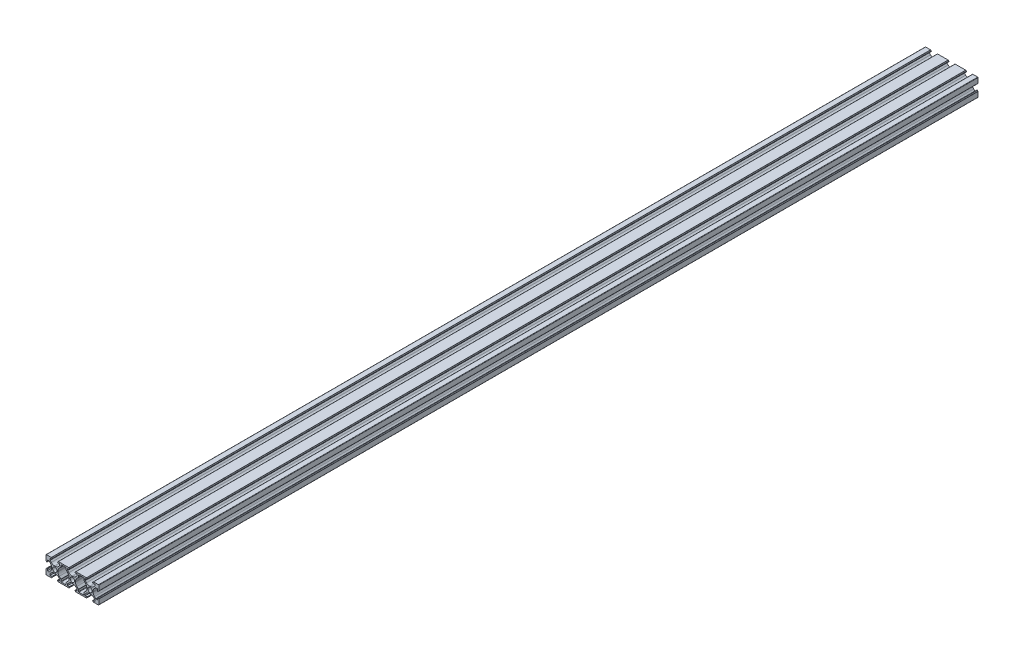
from build123d import *

# Parameters (mm, degrees)
RESSALTO_EXTRUS_O1_DEPTH    = 1000
PADR_OCIRCULAR1_COUNT       = 4
PADR_O_LINEAR1_COUNT        = 3
PADR_O_LINEAR1_PITCH        = 20
PADR_O_LINEAR1_COPY_1_DEPTH = 1000
PADR_O_LINEAR1_COPY_2_DEPTH = 1000
PADR_O_LINEAR1_COPY_3_DEPTH = 1000
PADR_O_LINEAR1_COPY_4_DEPTH = 1000
PADR_O_LINEAR1_COPY_5_DEPTH = 1000
PADR_O_LINEAR1_COPY_6_DEPTH = 1000
CORTE_EXTRUS_O1_DEPTH       = 1002.299156097
PADR_O_LINEAR2_COUNT        = 2
PADR_O_LINEAR2_PITCH        = 20
FILETE1_R                   = 0.4
FILETE2_R                   = 0.4


with BuildPart() as part:
    # Esboço1 → Ressalto-extrusão1 (new body)
    with BuildSketch(Plane.XY):
        with BuildLine():
            ThreePointArc((-9.317157288, 3.217157288), (-9.187387948, 3.130448187), (-9.034314575, 3.1))
            Line((-9.034314575, 3.1), (-8.9, 3.1))
            ThreePointArc((-8.9, 3.1), (-8.617157288, 3.217157288), (-8.5, 3.5))
            Line((-8.5, 3.5), (-8.5, 5.5))
            Line((-8.5, 5.5), (-6.560660172, 5.5))
            Line((-6.560660172, 5.5), (-5.064466094, 4.003805922))
            ThreePointArc((-5.064466094, 4.003805922), (-3.980602337, 2.381689178), (-3.6, 0.468272016))
            Line((-3.6, 0.468272016), (-3.6, 0))
            Line((-3.6, 0), (-2.5, 0))
            ThreePointArc((-2.5, 0), (-1.767766953, 1.767766953), (0, 2.5))
            Line((0, 2.5), (0, 3.6))
            Line((0, 3.6), (-0.468272016, 3.6))
            ThreePointArc((-0.468272016, 3.6), (-2.381689178, 3.980602337), (-4.003805922, 5.064466094))
            Line((-4.003805922, 5.064466094), (-5.5, 6.560660172))
            Line((-5.5, 6.560660172), (-5.5, 8.5))
            Line((-5.5, 8.5), (-3.5, 8.5))
            ThreePointArc((-3.5, 8.5), (-3.217157288, 8.617157288), (-3.1, 8.9))
            Line((-3.1, 8.9), (-3.1, 9.034314575))
            ThreePointArc((-3.1, 9.034314575), (-3.130448187, 9.187387948), (-3.217157288, 9.317157288))
            Line((-3.217157288, 9.317157288), (-3.782842712, 9.882842712))
            ThreePointArc((-3.782842712, 9.882842712), (-3.912612052, 9.969551813), (-4.065685425, 10))
            Line((-4.065685425, 10), (-10, 10))
            Line((-10, 10), (-10, 4.065685425))
            ThreePointArc((-10, 4.065685425), (-9.969551813, 3.912612052), (-9.882842712, 3.782842712))
            Line((-9.882842712, 3.782842712), (-9.317157288, 3.217157288))
        make_face()
    ressalto_extrus_o1 = extrude(amount=RESSALTO_EXTRUS_O1_DEPTH)

    # PadrãoCircular1: Ressalto-extrusão1 ×4 about axis
    padr_ocircular1_axis = Axis((0, 0, 0), (0, 0, 1))
    for i in range(1, PADR_OCIRCULAR1_COUNT):
        add(ressalto_extrus_o1.rotate(padr_ocircular1_axis, i * 360 / PADR_OCIRCULAR1_COUNT))

    # Padrão linear1: Ressalto-extrusão1 ×3
    with Locations(*[(i * PADR_O_LINEAR1_PITCH, 0, 0) for i in range(1, PADR_O_LINEAR1_COUNT)]):
        add(ressalto_extrus_o1)

    # Padrão linear1 copy 1 sketch → Padrão linear1 copy 1 (add)
    with BuildSketch(Plane(origin=(20, 0, 0), x_dir=(0, 1, 0), z_dir=(0, 0, 1))):
        with BuildLine():
            ThreePointArc((-9.317157288, 3.217157288), (-9.187387948, 3.130448187), (-9.034314575, 3.1))
            Line((-9.034314575, 3.1), (-8.9, 3.1))
            ThreePointArc((-8.9, 3.1), (-8.617157288, 3.217157288), (-8.5, 3.5))
            Line((-8.5, 3.5), (-8.5, 5.5))
            Line((-8.5, 5.5), (-6.560660172, 5.5))
            Line((-6.560660172, 5.5), (-5.064466094, 4.003805922))
            ThreePointArc((-5.064466094, 4.003805922), (-3.980602337, 2.381689178), (-3.6, 0.468272016))
            Line((-3.6, 0.468272016), (-3.6, 0))
            Line((-3.6, 0), (-2.5, 0))
            ThreePointArc((-2.5, 0), (-1.767766953, 1.767766953), (0, 2.5))
            Line((0, 2.5), (0, 3.6))
            Line((0, 3.6), (-0.468272016, 3.6))
            ThreePointArc((-0.468272016, 3.6), (-2.381689178, 3.980602337), (-4.003805922, 5.064466094))
            Line((-4.003805922, 5.064466094), (-5.5, 6.560660172))
            Line((-5.5, 6.560660172), (-5.5, 8.5))
            Line((-5.5, 8.5), (-3.5, 8.5))
            ThreePointArc((-3.5, 8.5), (-3.217157288, 8.617157288), (-3.1, 8.9))
            Line((-3.1, 8.9), (-3.1, 9.034314575))
            ThreePointArc((-3.1, 9.034314575), (-3.130448187, 9.187387948), (-3.217157288, 9.317157288))
            Line((-3.217157288, 9.317157288), (-3.782842712, 9.882842712))
            ThreePointArc((-3.782842712, 9.882842712), (-3.912612052, 9.969551813), (-4.065685425, 10))
            Line((-4.065685425, 10), (-10, 10))
            Line((-10, 10), (-10, 4.065685425))
            ThreePointArc((-10, 4.065685425), (-9.969551813, 3.912612052), (-9.882842712, 3.782842712))
            Line((-9.882842712, 3.782842712), (-9.317157288, 3.217157288))
        make_face()
    extrude(amount=PADR_O_LINEAR1_COPY_1_DEPTH)

    # Padrão linear1 copy 2 sketch → Padrão linear1 copy 2 (add)
    with BuildSketch(Plane(origin=(40, 0, 0), x_dir=(0, 1, 0), z_dir=(0, 0, 1))):
        with BuildLine():
            ThreePointArc((-9.317157288, 3.217157288), (-9.187387948, 3.130448187), (-9.034314575, 3.1))
            Line((-9.034314575, 3.1), (-8.9, 3.1))
            ThreePointArc((-8.9, 3.1), (-8.617157288, 3.217157288), (-8.5, 3.5))
            Line((-8.5, 3.5), (-8.5, 5.5))
            Line((-8.5, 5.5), (-6.560660172, 5.5))
            Line((-6.560660172, 5.5), (-5.064466094, 4.003805922))
            ThreePointArc((-5.064466094, 4.003805922), (-3.980602337, 2.381689178), (-3.6, 0.468272016))
            Line((-3.6, 0.468272016), (-3.6, 0))
            Line((-3.6, 0), (-2.5, 0))
            ThreePointArc((-2.5, 0), (-1.767766953, 1.767766953), (0, 2.5))
            Line((0, 2.5), (0, 3.6))
            Line((0, 3.6), (-0.468272016, 3.6))
            ThreePointArc((-0.468272016, 3.6), (-2.381689178, 3.980602337), (-4.003805922, 5.064466094))
            Line((-4.003805922, 5.064466094), (-5.5, 6.560660172))
            Line((-5.5, 6.560660172), (-5.5, 8.5))
            Line((-5.5, 8.5), (-3.5, 8.5))
            ThreePointArc((-3.5, 8.5), (-3.217157288, 8.617157288), (-3.1, 8.9))
            Line((-3.1, 8.9), (-3.1, 9.034314575))
            ThreePointArc((-3.1, 9.034314575), (-3.130448187, 9.187387948), (-3.217157288, 9.317157288))
            Line((-3.217157288, 9.317157288), (-3.782842712, 9.882842712))
            ThreePointArc((-3.782842712, 9.882842712), (-3.912612052, 9.969551813), (-4.065685425, 10))
            Line((-4.065685425, 10), (-10, 10))
            Line((-10, 10), (-10, 4.065685425))
            ThreePointArc((-10, 4.065685425), (-9.969551813, 3.912612052), (-9.882842712, 3.782842712))
            Line((-9.882842712, 3.782842712), (-9.317157288, 3.217157288))
        make_face()
    extrude(amount=PADR_O_LINEAR1_COPY_2_DEPTH)

    # Padrão linear1 copy 3 sketch → Padrão linear1 copy 3 (add)
    with BuildSketch(Plane(origin=(20, 0, 0), x_dir=(-1, 0, 0), z_dir=(0, 0, 1))):
        with BuildLine():
            ThreePointArc((-9.317157288, 3.217157288), (-9.187387948, 3.130448187), (-9.034314575, 3.1))
            Line((-9.034314575, 3.1), (-8.9, 3.1))
            ThreePointArc((-8.9, 3.1), (-8.617157288, 3.217157288), (-8.5, 3.5))
            Line((-8.5, 3.5), (-8.5, 5.5))
            Line((-8.5, 5.5), (-6.560660172, 5.5))
            Line((-6.560660172, 5.5), (-5.064466094, 4.003805922))
            ThreePointArc((-5.064466094, 4.003805922), (-3.980602337, 2.381689178), (-3.6, 0.468272016))
            Line((-3.6, 0.468272016), (-3.6, 0))
            Line((-3.6, 0), (-2.5, 0))
            ThreePointArc((-2.5, 0), (-1.767766953, 1.767766953), (0, 2.5))
            Line((0, 2.5), (0, 3.6))
            Line((0, 3.6), (-0.468272016, 3.6))
            ThreePointArc((-0.468272016, 3.6), (-2.381689178, 3.980602337), (-4.003805922, 5.064466094))
            Line((-4.003805922, 5.064466094), (-5.5, 6.560660172))
            Line((-5.5, 6.560660172), (-5.5, 8.5))
            Line((-5.5, 8.5), (-3.5, 8.5))
            ThreePointArc((-3.5, 8.5), (-3.217157288, 8.617157288), (-3.1, 8.9))
            Line((-3.1, 8.9), (-3.1, 9.034314575))
            ThreePointArc((-3.1, 9.034314575), (-3.130448187, 9.187387948), (-3.217157288, 9.317157288))
            Line((-3.217157288, 9.317157288), (-3.782842712, 9.882842712))
            ThreePointArc((-3.782842712, 9.882842712), (-3.912612052, 9.969551813), (-4.065685425, 10))
            Line((-4.065685425, 10), (-10, 10))
            Line((-10, 10), (-10, 4.065685425))
            ThreePointArc((-10, 4.065685425), (-9.969551813, 3.912612052), (-9.882842712, 3.782842712))
            Line((-9.882842712, 3.782842712), (-9.317157288, 3.217157288))
        make_face()
    extrude(amount=PADR_O_LINEAR1_COPY_3_DEPTH)

    # Padrão linear1 copy 4 sketch → Padrão linear1 copy 4 (add)
    with BuildSketch(Plane(origin=(40, 0, 0), x_dir=(-1, 0, 0), z_dir=(0, 0, 1))):
        with BuildLine():
            ThreePointArc((-9.317157288, 3.217157288), (-9.187387948, 3.130448187), (-9.034314575, 3.1))
            Line((-9.034314575, 3.1), (-8.9, 3.1))
            ThreePointArc((-8.9, 3.1), (-8.617157288, 3.217157288), (-8.5, 3.5))
            Line((-8.5, 3.5), (-8.5, 5.5))
            Line((-8.5, 5.5), (-6.560660172, 5.5))
            Line((-6.560660172, 5.5), (-5.064466094, 4.003805922))
            ThreePointArc((-5.064466094, 4.003805922), (-3.980602337, 2.381689178), (-3.6, 0.468272016))
            Line((-3.6, 0.468272016), (-3.6, 0))
            Line((-3.6, 0), (-2.5, 0))
            ThreePointArc((-2.5, 0), (-1.767766953, 1.767766953), (0, 2.5))
            Line((0, 2.5), (0, 3.6))
            Line((0, 3.6), (-0.468272016, 3.6))
            ThreePointArc((-0.468272016, 3.6), (-2.381689178, 3.980602337), (-4.003805922, 5.064466094))
            Line((-4.003805922, 5.064466094), (-5.5, 6.560660172))
            Line((-5.5, 6.560660172), (-5.5, 8.5))
            Line((-5.5, 8.5), (-3.5, 8.5))
            ThreePointArc((-3.5, 8.5), (-3.217157288, 8.617157288), (-3.1, 8.9))
            Line((-3.1, 8.9), (-3.1, 9.034314575))
            ThreePointArc((-3.1, 9.034314575), (-3.130448187, 9.187387948), (-3.217157288, 9.317157288))
            Line((-3.217157288, 9.317157288), (-3.782842712, 9.882842712))
            ThreePointArc((-3.782842712, 9.882842712), (-3.912612052, 9.969551813), (-4.065685425, 10))
            Line((-4.065685425, 10), (-10, 10))
            Line((-10, 10), (-10, 4.065685425))
            ThreePointArc((-10, 4.065685425), (-9.969551813, 3.912612052), (-9.882842712, 3.782842712))
            Line((-9.882842712, 3.782842712), (-9.317157288, 3.217157288))
        make_face()
    extrude(amount=PADR_O_LINEAR1_COPY_4_DEPTH)

    # Padrão linear1 copy 5 sketch → Padrão linear1 copy 5 (add)
    with BuildSketch(Plane(origin=(20, 0, 0), x_dir=(0, -1, 0), z_dir=(0, 0, 1))):
        with BuildLine():
            ThreePointArc((-9.317157288, 3.217157288), (-9.187387948, 3.130448187), (-9.034314575, 3.1))
            Line((-9.034314575, 3.1), (-8.9, 3.1))
            ThreePointArc((-8.9, 3.1), (-8.617157288, 3.217157288), (-8.5, 3.5))
            Line((-8.5, 3.5), (-8.5, 5.5))
            Line((-8.5, 5.5), (-6.560660172, 5.5))
            Line((-6.560660172, 5.5), (-5.064466094, 4.003805922))
            ThreePointArc((-5.064466094, 4.003805922), (-3.980602337, 2.381689178), (-3.6, 0.468272016))
            Line((-3.6, 0.468272016), (-3.6, 0))
            Line((-3.6, 0), (-2.5, 0))
            ThreePointArc((-2.5, 0), (-1.767766953, 1.767766953), (0, 2.5))
            Line((0, 2.5), (0, 3.6))
            Line((0, 3.6), (-0.468272016, 3.6))
            ThreePointArc((-0.468272016, 3.6), (-2.381689178, 3.980602337), (-4.003805922, 5.064466094))
            Line((-4.003805922, 5.064466094), (-5.5, 6.560660172))
            Line((-5.5, 6.560660172), (-5.5, 8.5))
            Line((-5.5, 8.5), (-3.5, 8.5))
            ThreePointArc((-3.5, 8.5), (-3.217157288, 8.617157288), (-3.1, 8.9))
            Line((-3.1, 8.9), (-3.1, 9.034314575))
            ThreePointArc((-3.1, 9.034314575), (-3.130448187, 9.187387948), (-3.217157288, 9.317157288))
            Line((-3.217157288, 9.317157288), (-3.782842712, 9.882842712))
            ThreePointArc((-3.782842712, 9.882842712), (-3.912612052, 9.969551813), (-4.065685425, 10))
            Line((-4.065685425, 10), (-10, 10))
            Line((-10, 10), (-10, 4.065685425))
            ThreePointArc((-10, 4.065685425), (-9.969551813, 3.912612052), (-9.882842712, 3.782842712))
            Line((-9.882842712, 3.782842712), (-9.317157288, 3.217157288))
        make_face()
    extrude(amount=PADR_O_LINEAR1_COPY_5_DEPTH)

    # Padrão linear1 copy 6 sketch → Padrão linear1 copy 6 (add)
    with BuildSketch(Plane(origin=(40, 0, 0), x_dir=(0, -1, 0), z_dir=(0, 0, 1))):
        with BuildLine():
            ThreePointArc((-9.317157288, 3.217157288), (-9.187387948, 3.130448187), (-9.034314575, 3.1))
            Line((-9.034314575, 3.1), (-8.9, 3.1))
            ThreePointArc((-8.9, 3.1), (-8.617157288, 3.217157288), (-8.5, 3.5))
            Line((-8.5, 3.5), (-8.5, 5.5))
            Line((-8.5, 5.5), (-6.560660172, 5.5))
            Line((-6.560660172, 5.5), (-5.064466094, 4.003805922))
            ThreePointArc((-5.064466094, 4.003805922), (-3.980602337, 2.381689178), (-3.6, 0.468272016))
            Line((-3.6, 0.468272016), (-3.6, 0))
            Line((-3.6, 0), (-2.5, 0))
            ThreePointArc((-2.5, 0), (-1.767766953, 1.767766953), (0, 2.5))
            Line((0, 2.5), (0, 3.6))
            Line((0, 3.6), (-0.468272016, 3.6))
            ThreePointArc((-0.468272016, 3.6), (-2.381689178, 3.980602337), (-4.003805922, 5.064466094))
            Line((-4.003805922, 5.064466094), (-5.5, 6.560660172))
            Line((-5.5, 6.560660172), (-5.5, 8.5))
            Line((-5.5, 8.5), (-3.5, 8.5))
            ThreePointArc((-3.5, 8.5), (-3.217157288, 8.617157288), (-3.1, 8.9))
            Line((-3.1, 8.9), (-3.1, 9.034314575))
            ThreePointArc((-3.1, 9.034314575), (-3.130448187, 9.187387948), (-3.217157288, 9.317157288))
            Line((-3.217157288, 9.317157288), (-3.782842712, 9.882842712))
            ThreePointArc((-3.782842712, 9.882842712), (-3.912612052, 9.969551813), (-4.065685425, 10))
            Line((-4.065685425, 10), (-10, 10))
            Line((-10, 10), (-10, 4.065685425))
            ThreePointArc((-10, 4.065685425), (-9.969551813, 3.912612052), (-9.882842712, 3.782842712))
            Line((-9.882842712, 3.782842712), (-9.317157288, 3.217157288))
        make_face()
    extrude(amount=PADR_O_LINEAR1_COPY_6_DEPTH)

    # Esboço4 → Corte-extrusão1 (cut, through all)
    with BuildSketch(Plane(origin=(0, 0, 0), x_dir=(-1, 0, 0), z_dir=(0, 0, -1))):
        Polygon((-13.439339828, 5.5), (-13, 5.939339828), (-13, 8.5), (-7, 8.5), (-7, 5.939339828), (-6.560660172, 5.5), (-6.560660172, -5.5), (-7, -5.939339828), (-7, -8.5), (-13, -8.5), (-13, -5.939339828), (-13.439339828, -5.5), align=None)
    corte_extrus_o1 = extrude(amount=-CORTE_EXTRUS_O1_DEPTH, mode=Mode.SUBTRACT)

    # Padrão linear2: Corte-extrusão1 ×2
    with Locations(*[(i * PADR_O_LINEAR2_PITCH, 0, 0) for i in range(1, PADR_O_LINEAR2_COUNT)]):
        add(corte_extrus_o1, mode=Mode.SUBTRACT)

    # Filete1
    filete1_edges = [part.edges().sort_by_distance(p)[0] for p in [
        (13, 5.939339828, 500),
        (13, 8.5, 500),
        (7, 8.5, 500),
        (7, 5.939339828, 500),
        (7, -5.939339828, 500),
        (7, -8.5, 500),
        (13, -8.5, 500),
        (13, -5.939339828, 500),
        (33, 5.939339828, 500),
        (33, 8.5, 500),
        (27, 8.5, 500),
        (27, 5.939339828, 500),
        (27, -5.939339828, 500),
        (27, -8.5, 500),
        (33, -8.5, 500),
        (33, -5.939339828, 500),
    ]]
    fillet(filete1_edges, radius=FILETE1_R)

    # Filete2
    filete2_edges = [part.edges().sort_by_distance(p)[0] for p in [
        (-10, 10, 500),
        (50, -10, 500),
        (50, 10, 500),
        (-10, -10, 500),
    ]]
    fillet(filete2_edges, radius=FILETE2_R)


solid = part.part
